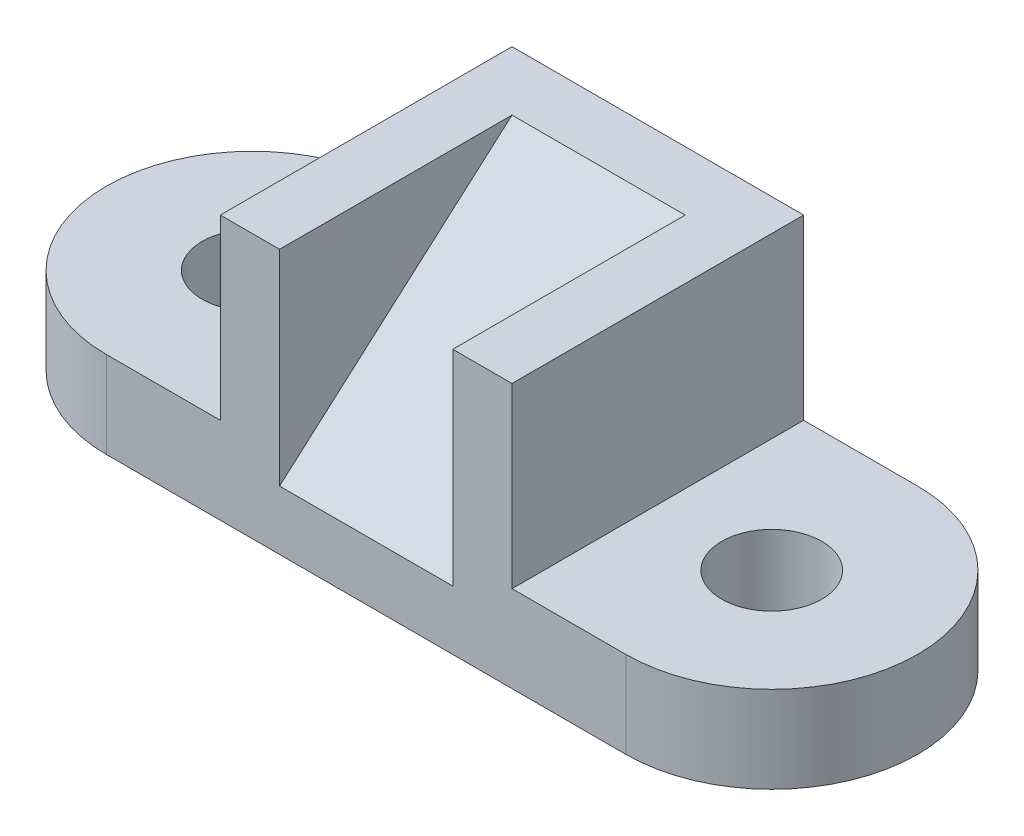
from build123d import *

# Parameters (mm, degrees)
SKETCH1_R               = 11
BOSS_EXTRUDE1_DEPTH     = 13
SKETCH2_W               = 38
SKETCH2_H               = 51
BOSS_EXTRUDE3_DEPTH     = 45
CUT_EXTRUDE1_DEPTH      = 127.696487718
CUT_EXTRUDE1_DEPTH_BACK = 127.696487718
SKETCH4_R               = 11
BOSS_EXTRUDE4_DEPTH     = 6
BOSS_EXTRUDE5_DEPTH     = 39


with BuildPart() as part:
    # Sketch1 → Boss-Extrude1 (new body)
    with BuildSketch(Plane(origin=(0, 0, 0), x_dir=(1, 0, 0), z_dir=(0, 1, 0))):
        with BuildLine():
            Line((-57, 32), (57, 32))
            ThreePointArc((57, 32), (89, 0), (57, -32))
            Line((57, -32), (-57, -32))
            ThreePointArc((-57, -32), (-89, 0), (-57, 32))
        make_face()
        with Locations(Location((-57, 0, 0), (0, 0, 90))):
            Circle(SKETCH1_R, mode=Mode.SUBTRACT)
        with Locations(Location((57, 0, 0), (0, 0, 90))):
            Circle(SKETCH1_R, mode=Mode.SUBTRACT)
    extrude(amount=BOSS_EXTRUDE1_DEPTH)

    # Sketch2 → Boss-Extrude3 (add)
    with BuildSketch(Plane(origin=(0, 13, 0), x_dir=(1, 0, 0), z_dir=(0, 1, 0))):
        with Locations((0, -6.5)):
            Rectangle(SKETCH2_W, SKETCH2_H)
    extrude(amount=BOSS_EXTRUDE3_DEPTH)

    # Sketch3 → Cut-Extrude1 (cut, two sides: drawn at the far end of the back side and taken through both)
    with BuildSketch(Plane.ZY.offset(19).offset(-CUT_EXTRUDE1_DEPTH_BACK)):
        Polygon((-143.828237157, 168.142562197), (-19, 58), (32, 13), (156.828237157, -97.142562197), (377.113361551, 152.513912116), (76.456887238, 417.799036511), align=None)
    extrude(amount=CUT_EXTRUDE1_DEPTH + CUT_EXTRUDE1_DEPTH_BACK, mode=Mode.SUBTRACT)

    # Sketch4 → Boss-Extrude4 (add)
    with BuildSketch(Plane(origin=(0, 13, 0), x_dir=(1, 0, 0), z_dir=(0, 1, 0))):
        with BuildLine():
            ThreePointArc((-57, 32), (-89, 0), (-57, -32))
            Line((-57, -32), (-19, -32))
            Line((-19, -32), (-19, 19))
            Line((-19, 19), (19, 19))
            Line((19, 19), (19, -32))
            Line((19, -32), (57, -32))
            ThreePointArc((57, -32), (89, 0), (57, 32))
            Line((57, 32), (-57, 32))
        make_face()
        with Locations(Location((-57, 0, 0), (0, 0, 90))):
            Circle(SKETCH4_R, mode=Mode.SUBTRACT)
        with Locations(Location((57, 0, 0), (0, 0, 90))):
            Circle(SKETCH4_R, mode=Mode.SUBTRACT)
    extrude(amount=BOSS_EXTRUDE4_DEPTH)

    # Sketch5 → Boss-Extrude5 (add)
    with BuildSketch(Plane(origin=(0, 19, 0), x_dir=(1, 0, 0), z_dir=(0, 1, 0))):
        Polygon((-32, 32), (32, 32), (32, -32), (19, -32), (19, -25.2), (19, 19), (-19, 19), (-19, -25.2), (-19, -32), (-32, -32), align=None)
    extrude(amount=BOSS_EXTRUDE5_DEPTH)


solid = part.part
